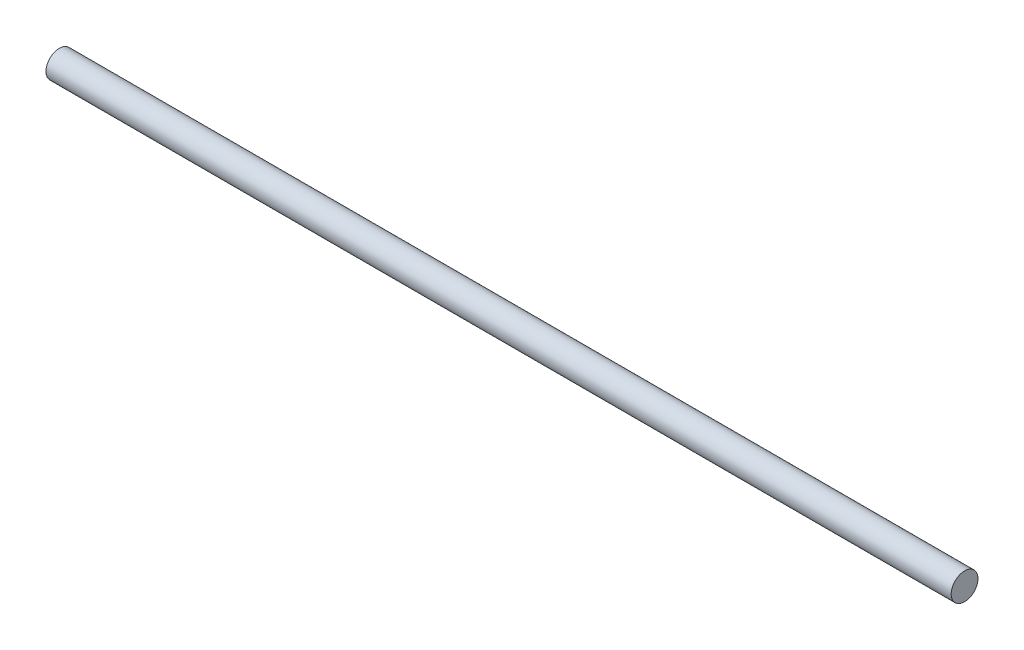
from build123d import *

# Parameters (mm, degrees)
SKETCH1_R           = 4
BOSS_EXTRUDE1_DEPTH = 270


with BuildPart() as part:
    # Sketch1 → Boss-Extrude1 (new body)
    with BuildSketch(Plane(origin=(0, 0, 0), x_dir=(0, 0, -1), z_dir=(1, 0, 0))):
        Circle(SKETCH1_R)
    extrude(amount=BOSS_EXTRUDE1_DEPTH)


solid = part.part
